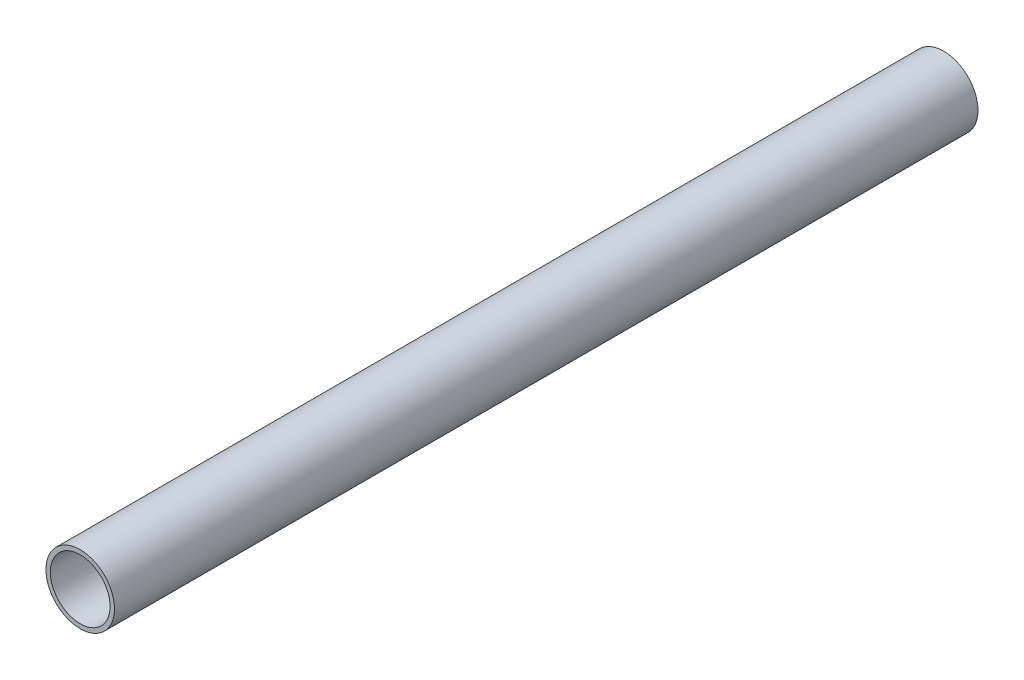
from build123d import *

# Parameters (mm, degrees)
SKETCH1_R           = 7.9375
SKETCH1_R_2         = 6.9215
BOSS_EXTRUDE1_DEPTH = 100


with BuildPart() as part:
    # Sketch1 → Boss-Extrude1 (new, symmetric)
    with BuildSketch(Plane.XY):
        Circle(SKETCH1_R)
        Circle(SKETCH1_R_2, mode=Mode.SUBTRACT)
    extrude(amount=BOSS_EXTRUDE1_DEPTH, both=True)


solid = part.part
